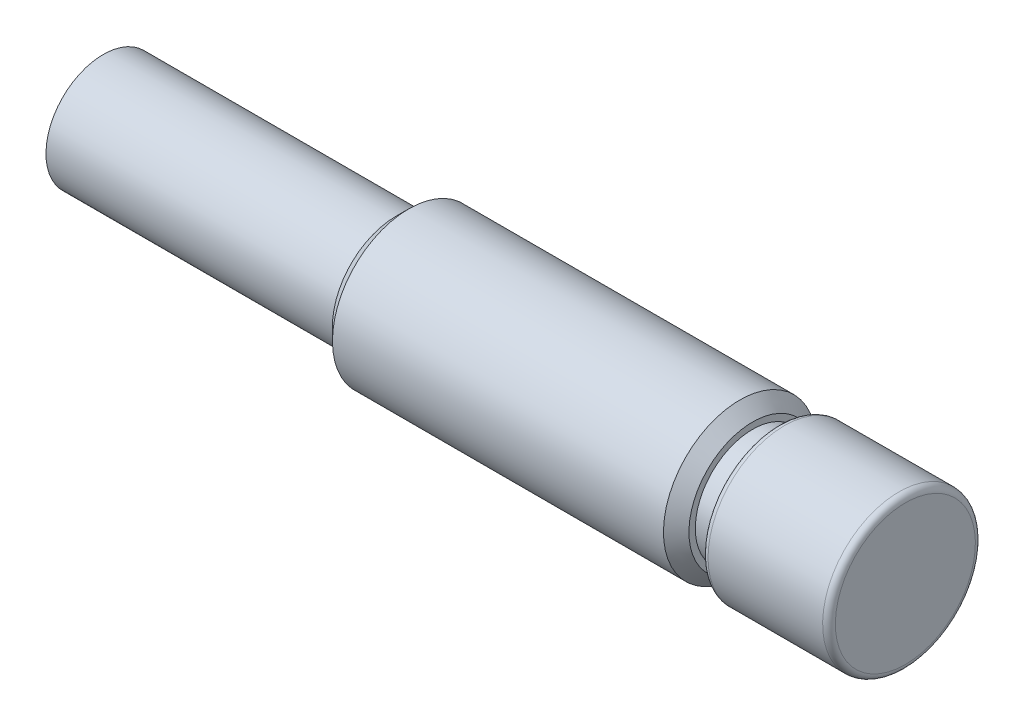
from build123d import *

# Parameters (mm, degrees)
FILETE1_R     = 0.5
CHANFRO1_SIZE = 1


with BuildPart() as part:
    # Esboço1 → Revolução1 (revolve)
    with BuildSketch(Plane.XY, mode=Mode.PRIVATE) as revolu_o1_sk:
        Polygon((3.39980648, 0), (63, 0), (63, 6), (53, 6), (53, 4.5), (51, 4.5), (51, 6), (23, 6), (23, 4.5), (0, 4.5), (0, 4.356416698), align=None)
    revolve(revolu_o1_sk.sketch.rotate(Axis((3.39980648, 0, 0), (1, 0, 0)), 180), axis=Axis((3.39980648, 0, 0), (1, 0, 0)))

    # Filete1
    filete1_edges = [part.edges().sort_by_distance(p)[0] for p in [
        (53, 6, 0),
        (63, 6, 0),
    ]]
    fillet(filete1_edges, radius=FILETE1_R)

    # Chanfro1
    chanfro1_edges = [part.edges().sort_by_distance(p)[0] for p in [
        (51, 6, 0),
        (23, 6, 0),
    ]]
    chamfer(chanfro1_edges, length=CHANFRO1_SIZE)


solid = part.part
